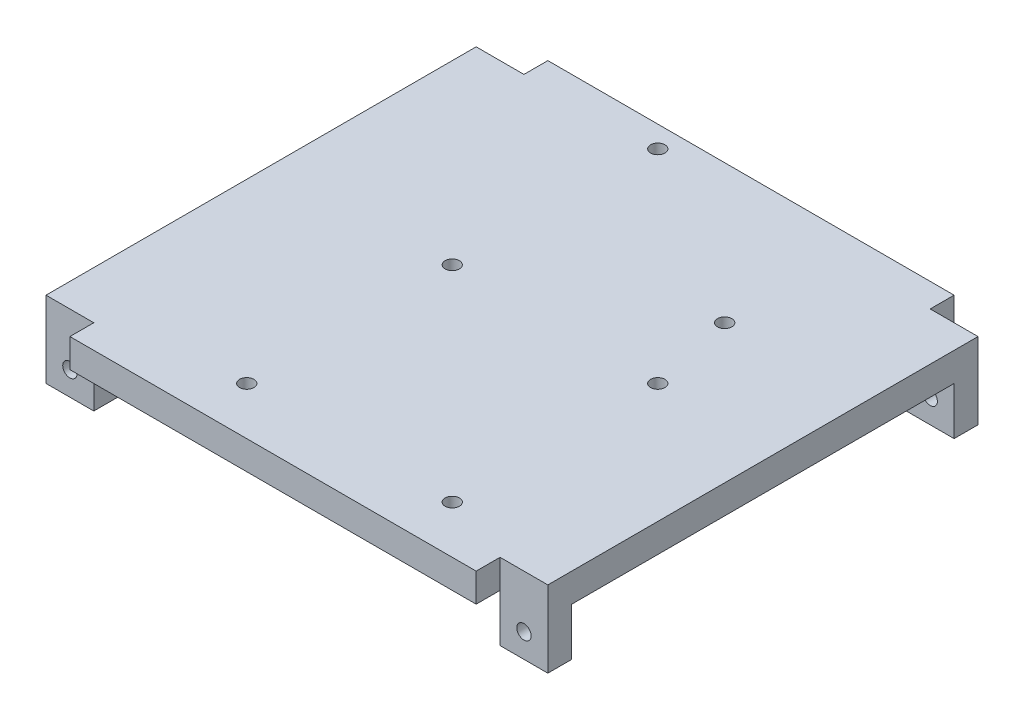
from build123d import *

# Parameters (mm, degrees)
SKETCH1_W           = 105
SKETCH1_H           = 100
BOSS_EXTRUDE1_DEPTH = 6
SKETCH2_W           = 10
SKETCH2_H           = 5
CUT_EXTRUDE1_DEPTH  = 10
SKETCH3_W           = 10
SKETCH3_H           = 5
BOSS_EXTRUDE2_DEPTH = 10
SKETCH4_R           = 1.5
CUT_EXTRUDE2_DEPTH  = 142.950695666
SKETCH5_R           = 1.5
CUT_EXTRUDE4_DEPTH  = 6
SKETCH6_R           = 1.5
CUT_EXTRUDE5_DEPTH  = 6


with BuildPart() as part:
    # Sketch1 → Boss-Extrude1 (new body)
    with BuildSketch(Plane(origin=(0, 0, 0), x_dir=(1, 0, 0), z_dir=(0, 1, 0))):
        with Locations((52.5, 50)):
            Rectangle(SKETCH1_W, SKETCH1_H)
    extrude(amount=BOSS_EXTRUDE1_DEPTH)

    # Sketch2 → Cut-Extrude1 (cut)
    with BuildSketch(Plane.XZ):
        with Locations((100, -97.5)):
            Rectangle(SKETCH2_W, SKETCH2_H)
        with Locations((5, -97.5)):
            Rectangle(SKETCH2_W, SKETCH2_H)
        with Locations((100, -2.5)):
            Rectangle(SKETCH2_W, SKETCH2_H)
        with Locations((5, -2.5)):
            Rectangle(SKETCH2_W, SKETCH2_H)
    extrude(amount=-CUT_EXTRUDE1_DEPTH, mode=Mode.SUBTRACT)

    # Sketch3 → Boss-Extrude2 (add)
    with BuildSketch(Plane(origin=(0, 0, 0), x_dir=(-1, 0, 0), z_dir=(0, -1, 0))):
        with Locations((-100, 92.5)):
            Rectangle(SKETCH3_W, SKETCH3_H)
        with Locations((-100, 7.5)):
            Rectangle(SKETCH3_W, SKETCH3_H)
        with Locations((-5, 7.5)):
            Rectangle(SKETCH3_W, SKETCH3_H)
        with Locations((-5, 92.5)):
            Rectangle(SKETCH3_W, SKETCH3_H)
    extrude(amount=BOSS_EXTRUDE2_DEPTH)

    # Sketch4 → Cut-Extrude2 (cut, through all)
    with BuildSketch(Plane(origin=(0, 0, -95), x_dir=(-1, 0, 0), z_dir=(0, 0, -1))):
        with Locations((-100, -5)):
            Circle(SKETCH4_R)
        with Locations((-5, -5)):
            Circle(SKETCH4_R)
    extrude(amount=-CUT_EXTRUDE2_DEPTH, mode=Mode.SUBTRACT)

    # Sketch5 → Cut-Extrude4 (cut)
    with BuildSketch(Plane(origin=(0, 0, 0), x_dir=(-1, 0, 0), z_dir=(0, -1, 0))):
        with Locations(Location((-37, 10, 0), (0, 0, 90))):
            Circle(SKETCH5_R)
        with Locations(Location((-37, 53, 0), (0, 0, 90))):
            Circle(SKETCH5_R)
        with Locations(Location((-80, 53, 0), (0, 0, 90))):
            Circle(SKETCH5_R)
        with Locations(Location((-80, 10, 0), (0, 0, 90))):
            Circle(SKETCH5_R)
    extrude(amount=-CUT_EXTRUDE4_DEPTH, mode=Mode.SUBTRACT)

    # Sketch6 → Cut-Extrude5 (cut)
    with BuildSketch(Plane(origin=(0, 0, 0), x_dir=(-1, 0, 0), z_dir=(0, -1, 0))):
        with Locations(Location((-37.5, 95.5, 0), (0, 0, 90))):
            Circle(SKETCH6_R)
        with Locations(Location((-76, 71, 0), (0, 0, 90))):
            Circle(SKETCH6_R)
    extrude(amount=-CUT_EXTRUDE5_DEPTH, mode=Mode.SUBTRACT)


solid = part.part
